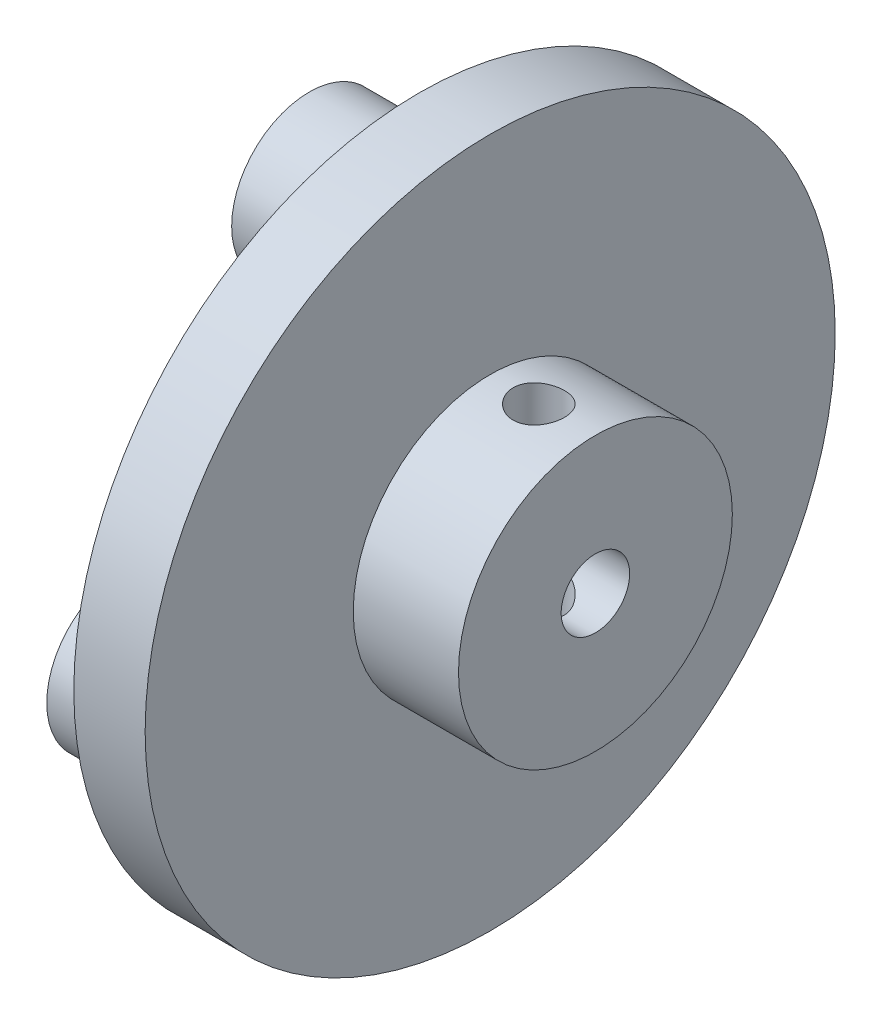
from build123d import *

# Parameters (mm, degrees)
SKETCH2_R               = 3.6
BOSS_EXTRUDE1_DEPTH     = 5.08
CUT_EXTRUDE1_DEPTH      = 27.23020328
CUT_EXTRUDE1_DEPTH_BACK = 27.23020328
SKETCH3_R               = 1.190625


with BuildPart() as part:
    # Sketch1 → Revolve1 (revolve)
    with BuildSketch(Plane.XY):
        Polygon((0, 1.5875), (0, 6.35), (-4.87911158, 6.35), (-4.87911158, 16), (-8.187387237, 16), (-8.187387237, 5), (-6.426815736, 5), (-6.426815736, 1.5875), align=None)
    revolve(axis=Axis((0, 0, 0), (-1, 0, 0)))

    # Sketch2 → Boss-Extrude1 (add)
    with BuildSketch(Plane.ZY.offset(8.187387237)):
        with Locations((0, 9.9)):
            Circle(SKETCH2_R)
        with Locations((8.573651497, -4.95)):
            Circle(SKETCH2_R)
        with Locations((-8.573651497, -4.95)):
            Circle(SKETCH2_R)
    extrude(amount=BOSS_EXTRUDE1_DEPTH)

    # Sketch3 → Cut-Extrude1 (cut, two sides: drawn at the far end of the back side and taken through both)
    with BuildSketch(Plane(origin=(0, 0, 0), x_dir=(1, 0, 0), z_dir=(0, 1, 0)).offset(-CUT_EXTRUDE1_DEPTH_BACK)):
        with Locations((-2.623694819, 0)):
            Circle(SKETCH3_R)
    extrude(amount=CUT_EXTRUDE1_DEPTH + CUT_EXTRUDE1_DEPTH_BACK, mode=Mode.SUBTRACT)


solid = part.part
